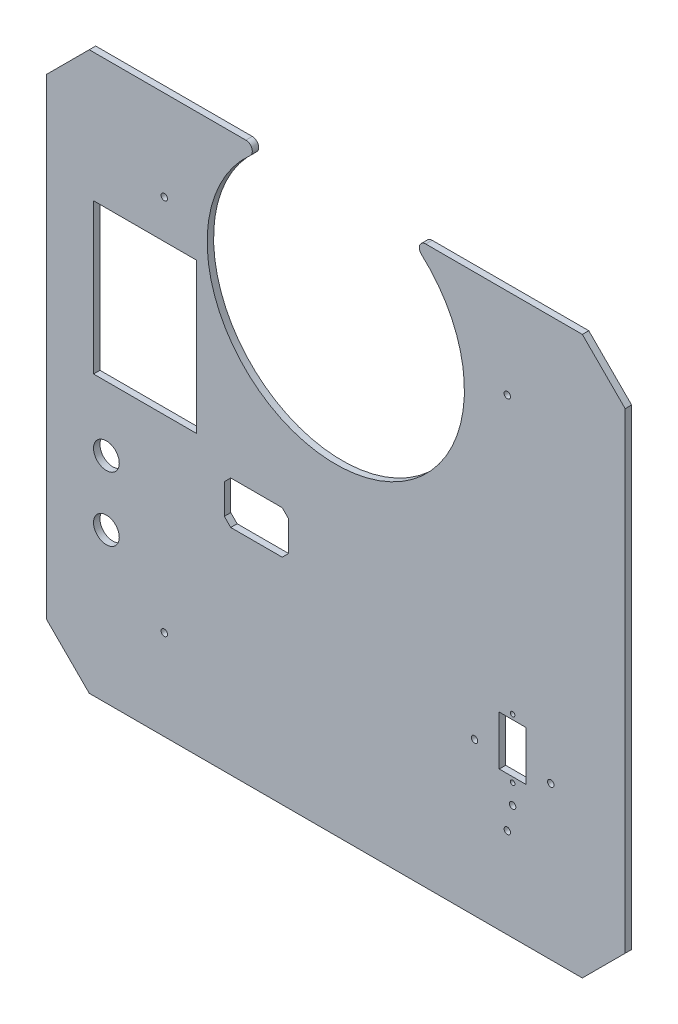
from build123d import *

# Parameters (mm, degrees)
SKETCH_1_W          = 270
SKETCH_1_H          = 260
EXTRUDE_1_DEPTH     = 3
CHAMFER_2_SIZE      = 20
SKETCH_4_R          = 60
CUT_EXTRUDE_1_DEPTH = 10
FILLET_1_R          = 3
SKETCH_5_R          = 1.5
SKETCH_5_R_2        = 1.05
SKETCH_5_W          = 12.5
SKETCH_5_H          = 23.002638066
CUT_EXTRUDE_2_DEPTH = 10
SKETCH_6_W          = 48
SKETCH_6_H          = 70
CUT_EXTRUDE_3_DEPTH = 0.1
SKETCH_10_W         = 48
SKETCH_10_H         = 70
CUT_EXTRUDE_4_DEPTH = 188.440657276
SKETCH_11_R         = 6
CUT_EXTRUDE_5_DEPTH = 188.440657276
SKETCH_13_R         = 1.5
CUT_EXTRUDE_6_DEPTH = 188.440657276
SKETCH_15_W         = 30
SKETCH_15_H         = 20
CUT_EXTRUDE_8_DEPTH = 188.440657276
CHAMFER_4_SIZE      = 3


with BuildPart() as part:
    # 草图1 → 凸台-拉伸1 (new body)
    with BuildSketch(Plane.XY):
        Rectangle(SKETCH_1_W, SKETCH_1_H)
    extrude(amount=EXTRUDE_1_DEPTH)

    # 倒角2
    chamfer_2_edges = [part.edges().sort_by_distance(p)[0] for p in [
        (135, -130, 1.5),
        (-135, -130, 1.5),
        (-135, 130, 1.5),
        (135, 130, 1.5),
    ]]
    chamfer(chamfer_2_edges, length=CHAMFER_2_SIZE)

    # 草图4 → 切除-拉伸1 (cut)
    with BuildSketch(Plane.XY.offset(3)):
        with Locations((0, 80)):
            Circle(SKETCH_4_R)
    extrude(amount=-CUT_EXTRUDE_1_DEPTH, mode=Mode.SUBTRACT)

    # 圆角1
    fillet_1_edges = [part.edges().sort_by_distance(p)[0] for p in [
        (33.166247904, 130, 1.5),
        (-33.166247904, 130, 1.5),
    ]]
    fillet(fillet_1_edges, radius=FILLET_1_R)

    # 草图5 → 切除-拉伸2 (cut)
    with BuildSketch(Plane(origin=(0, 0, 0), x_dir=(-1, 0, 0), z_dir=(0, 0, -1))):
        with Locations((-64.7, -58.75)):
            Circle(SKETCH_5_R)
        with Locations((-100.3, -58.75)):
            Circle(SKETCH_5_R)
        with Locations((-82.5, -76.55)):
            Circle(SKETCH_5_R)
        with Locations((-82.5, -39.65)):
            Circle(SKETCH_5_R_2)
        with Locations((-82.5, -67.35)):
            Circle(SKETCH_5_R_2)
        with Locations((-82.5, -53.445792921)):
            Rectangle(SKETCH_5_W, SKETCH_5_H)
    extrude(amount=-CUT_EXTRUDE_2_DEPTH, mode=Mode.SUBTRACT)

    # 草图6 → 切除-拉伸3 (cut)
    with BuildSketch(Plane(origin=(0, 0, 0), x_dir=(-1, 0, 0), z_dir=(0, 0, -1))):
        with Locations((89, 35)):
            Rectangle(SKETCH_6_W, SKETCH_6_H)
    extrude(amount=-CUT_EXTRUDE_3_DEPTH, mode=Mode.SUBTRACT)

    # 草图10 → 切除-拉伸4 (cut, through all)
    with BuildSketch(Plane(origin=(0, 0, 0), x_dir=(-1, 0, 0), z_dir=(0, 0, -1))):
        with Locations((89, 35)):
            Rectangle(SKETCH_10_W, SKETCH_10_H)
    extrude(amount=-CUT_EXTRUDE_4_DEPTH, mode=Mode.SUBTRACT)

    # 草图11 → 切除-拉伸5 (cut, through all)
    with BuildSketch(Plane.XY.offset(3)):
        with Locations((-107, -30)):
            Circle(SKETCH_11_R)
        with Locations((-107, -60)):
            Circle(SKETCH_11_R)
    extrude(amount=-CUT_EXTRUDE_5_DEPTH, mode=Mode.SUBTRACT)

    # 草图13 → 切除-拉伸6 (cut, through all)
    with BuildSketch(Plane(origin=(0, 0, 0), x_dir=(-1, 0, 0), z_dir=(0, 0, -1))):
        with Locations((80, 88)):
            Circle(SKETCH_13_R)
        with Locations((80, -88)):
            Circle(SKETCH_13_R)
        with Locations((-80, -88)):
            Circle(SKETCH_13_R)
        with Locations((-80, 88)):
            Circle(SKETCH_13_R)
    extrude(amount=-CUT_EXTRUDE_6_DEPTH, mode=Mode.SUBTRACT)

    # 草图15 → 切除-拉伸8 (cut, through all)
    with BuildSketch(Plane(origin=(0, 0, 0), x_dir=(-1, 0, 0), z_dir=(0, 0, -1))):
        with Locations((37, -20)):
            Rectangle(SKETCH_15_W, SKETCH_15_H)
    extrude(amount=-CUT_EXTRUDE_8_DEPTH, mode=Mode.SUBTRACT)

    # 倒角4
    chamfer_4_edges = [part.edges().sort_by_distance(p)[0] for p in [
        (-22, -30, 1.5),
        (-22, -10, 1.5),
        (-52, -10, 1.5),
        (-52, -30, 1.5),
    ]]
    chamfer(chamfer_4_edges, length=CHAMFER_4_SIZE)


solid = part.part
